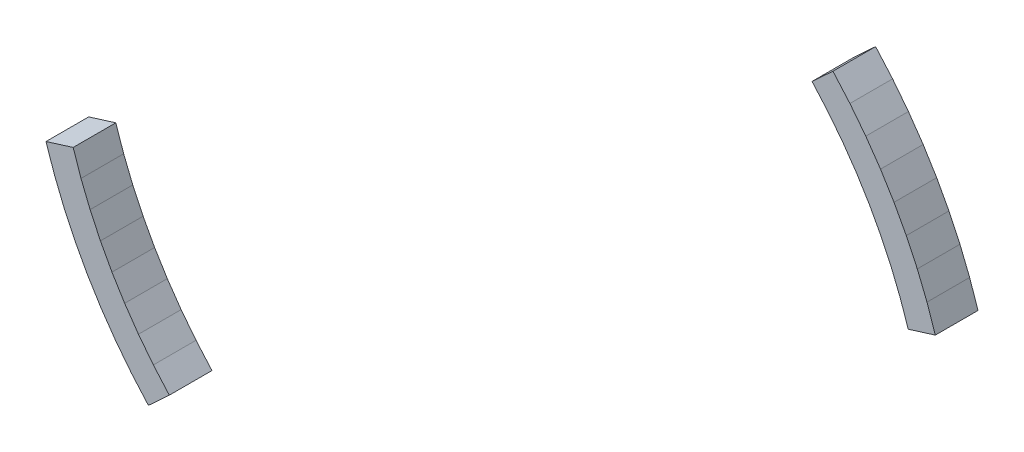
from build123d import *

# Parameters (mm, degrees)
EXTRUDE_START     = 5.5
EXTRUDE_1_DEPTH   = 6
EXTRUDE_1_2_DEPTH = 6


with BuildPart() as part:
    # 草圖1 → 填料-伸長1 (new body)
    with BuildSketch(Plane.XY.offset(EXTRUDE_START)):
        Polygon((62.536832367, 19.478054252), (61.3620314, 22.911811417), (59.998852171, 26.275230507), (58.451479569, 29.557985997), (56.724663948, 32.75), (54.823706543, 35.841473197), (52.754443194, 38.822914925), (50.523226434, 41.685172312), (48.136905982, 44.419458376), (45.197247602, 41.706819697), (47.43783856, 39.139512934), (49.532797809, 36.452049891), (51.475693929, 33.65268094), (53.260562333, 30.75), (54.881923565, 27.75291815), (56.33480013, 24.670636277), (57.614731773, 21.512616827), (58.717789169, 18.288554756), align=None)
    extrude(amount=EXTRUDE_1_DEPTH)


with BuildPart() as body_2:
    # 草圖1 → Extrude 1 2 (new body)
    with BuildSketch(Plane.XY.offset(EXTRUDE_START)):
        Polygon((-62.536832367, -19.478054252), (-61.3620314, -22.911811417), (-59.998852171, -26.275230507), (-58.451479569, -29.557985997), (-56.724663948, -32.75), (-54.823706543, -35.841473197), (-52.754443194, -38.822914925), (-50.523226434, -41.685172312), (-48.136905982, -44.419458376), (-45.197247602, -41.706819697), (-47.43783856, -39.139512934), (-49.532797809, -36.452049891), (-51.475693929, -33.65268094), (-53.260562333, -30.75), (-54.881923565, -27.75291815), (-56.33480013, -24.670636277), (-57.614731773, -21.512616827), (-58.717789169, -18.288554756), align=None)
    extrude(amount=EXTRUDE_1_2_DEPTH)


solid = Compound([part.part, body_2.part])
